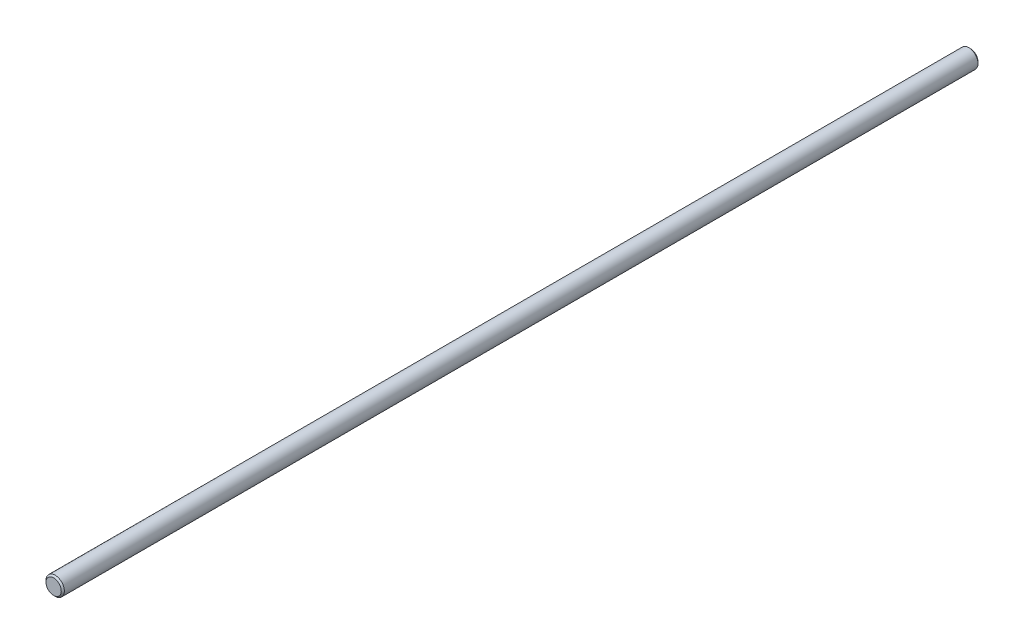
from build123d import *

# Parameters (mm, degrees)
SKETCH1_R           = 3
BOSS_EXTRUDE1_DEPTH = 300
CHAMFER1_SIZE       = 0.5


with BuildPart() as part:
    # Sketch1 → Boss-Extrude1 (new body)
    with BuildSketch(Plane.XY):
        Circle(SKETCH1_R)
    extrude(amount=BOSS_EXTRUDE1_DEPTH)

    # Chamfer1
    chamfer1_edges = [part.edges().sort_by_distance(p)[0] for p in [
        (-3, 0, 0),
        (-3, 0, 300),
    ]]
    chamfer(chamfer1_edges, length=CHAMFER1_SIZE)


solid = part.part
